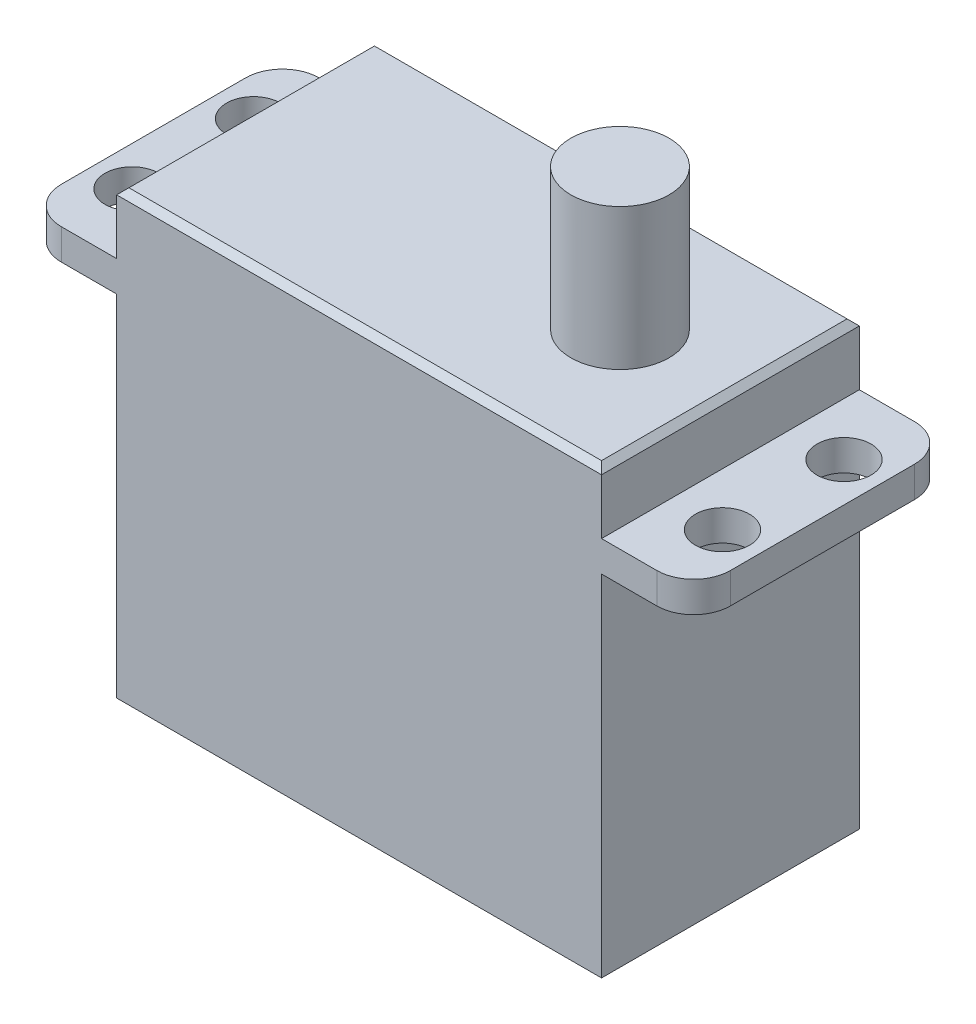
from build123d import *

# Parameters (mm, degrees)
SKETCH1_W            = 39.5
SKETCH1_H            = 21
BOSS_EXTRUDE1_DEPTH  = 36
SKETCH2_R            = 4
BOSS_EXTRUDE2_DEPTH  = 11.5
SKETCH4_W            = 21
SKETCH4_H            = 2.5
BOSS_EXTRUDE4_DEPTH  = 7.5
SKETCH5_R            = 2.2
CUT_EXTRUDE1_DEPTH   = 7.5
FILLET1_R            = 3
FILLET1_OF_MIRROR1_R = 3
CHAMFER1_SIZE        = 0.5


with BuildPart() as part:
    # Sketch1 → Boss-Extrude1 (new body)
    with BuildSketch(Plane(origin=(0, 0, 0), x_dir=(1, 0, 0), z_dir=(0, 1, 0))):
        Rectangle(SKETCH1_W, SKETCH1_H)
    extrude(amount=BOSS_EXTRUDE1_DEPTH)

    # Sketch2 → Boss-Extrude2 (add)
    with BuildSketch(Plane(origin=(0, 36, 0), x_dir=(1, 0, 0), z_dir=(0, 1, 0))):
        with Locations(Location((10.75, 0, 0), (0, 0, 90))):
            Circle(SKETCH2_R)
    extrude(amount=BOSS_EXTRUDE2_DEPTH)

    # Sketch4 → Boss-Extrude4 (add)
    with BuildSketch(Plane(origin=(19.75, 0, 0), x_dir=(0, 0, -1), z_dir=(1, 0, 0))):
        with Locations((0, 29.75)):
            Rectangle(SKETCH4_W, SKETCH4_H)
    boss_extrude4 = extrude(amount=BOSS_EXTRUDE4_DEPTH)

    # Sketch5 → Cut-Extrude1 (cut)
    with BuildSketch(Plane(origin=(0, 31, 0), x_dir=(1, 0, 0), z_dir=(0, 1, 0))):
        with Locations(Location((24.05, 4.95, 0), (0, 0, 270))):
            Circle(SKETCH5_R)
        with Locations(Location((24.05, -4.95, 0), (0, 0, 270))):
            Circle(SKETCH5_R)
    cut_extrude1 = extrude(amount=-CUT_EXTRUDE1_DEPTH, mode=Mode.SUBTRACT)

    # Fillet1
    fillet1_edges = [part.edges().sort_by_distance(p)[0] for p in [
        (27.25, 29.75, 10.5),
        (27.25, 29.75, -10.5),
    ]]
    fillet(fillet1_edges, radius=FILLET1_R)

    # Mirror1: Boss-Extrude4, Cut-Extrude1 across plane
    add(boss_extrude4.mirror(Plane(origin=(0, 0, 0), x_dir=(0, 0, 1), z_dir=(1, 0, 0))))
    add(cut_extrude1.mirror(Plane(origin=(0, 0, 0), x_dir=(0, 0, 1), z_dir=(1, 0, 0))), mode=Mode.SUBTRACT)

    # Fillet1 of Mirror1
    fillet1_of_mirror1_edges = [part.edges().sort_by_distance(p)[0] for p in [
        (-27.25, 29.75, 10.5),
        (-27.25, 29.75, -10.5),
    ]]
    fillet(fillet1_of_mirror1_edges, radius=FILLET1_OF_MIRROR1_R)

    # Chamfer1
    chamfer1_edges = [part.edges().sort_by_distance(p)[0] for p in [
        (-19.75, 36, 0),
        (0, 36, 10.5),
        (19.75, 36, 0),
        (0, 36, -10.5),
    ]]
    chamfer(chamfer1_edges, length=CHAMFER1_SIZE)


solid = part.part
